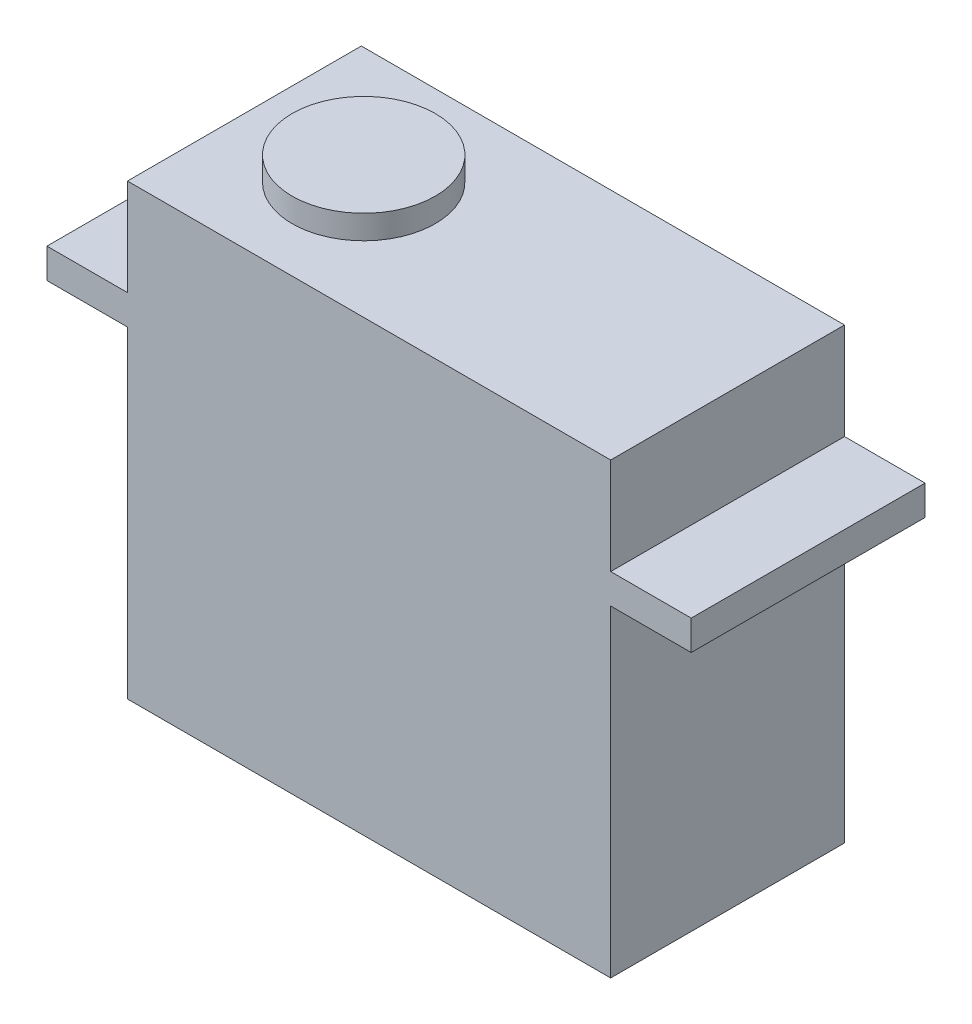
from build123d import *

# Parameters (mm, degrees)
SKETCH1_W           = 40.5
SKETCH1_H           = 19.6
BOSS_EXTRUDE1_DEPTH = 37.6
SKETCH2_R           = 6
BOSS_EXTRUDE2_DEPTH = 2
SKETCH3_W           = 6.75
SKETCH3_H           = 2.5
BOSS_EXTRUDE3_DEPTH = 19.6


with BuildPart() as part:
    # Sketch1 → Boss-Extrude1 (new body)
    with BuildSketch(Plane(origin=(0, 0, 0), x_dir=(1, 0, 0), z_dir=(0, 1, 0))):
        Rectangle(SKETCH1_W, SKETCH1_H)
    extrude(amount=BOSS_EXTRUDE1_DEPTH)

    # Sketch2 → Boss-Extrude2 (add)
    with BuildSketch(Plane(origin=(0, 37.6, 0), x_dir=(1, 0, 0), z_dir=(0, 1, 0))):
        with Locations(Location((-10.25, 0, 0), (0, 0, 90))):
            Circle(SKETCH2_R)
    extrude(amount=BOSS_EXTRUDE2_DEPTH)

    # Sketch3 → Boss-Extrude3 (add)
    with BuildSketch(Plane.XY.offset(9.8)):
        with Locations((-23.625, 28.25)):
            Rectangle(SKETCH3_W, SKETCH3_H)
        with Locations((23.625, 28.25)):
            Rectangle(SKETCH3_W, SKETCH3_H)
    extrude(amount=-BOSS_EXTRUDE3_DEPTH)


solid = part.part
